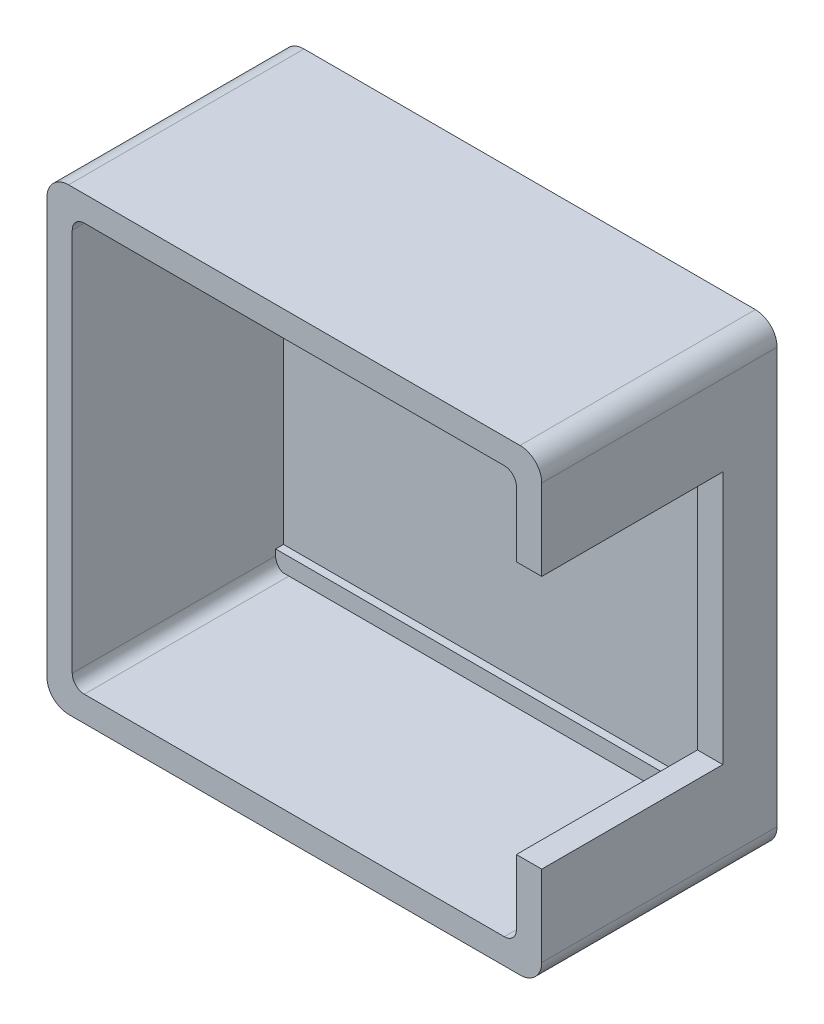
from build123d import *

# Parameters (mm, degrees)
FACTORY_ABS_FLOOR_41X38_DEPTH       = 2
FACTORY_ABS_SIDEWALLS_START         = 2
FACTORY_ABS_SIDEWALLS_DEPTH         = 17.5
FACTORY_TERMINAL_OPENING_START      = 4.5
FACTORY_TERMINAL_OPENING_SKETCH_W   = 3.2
FACTORY_TERMINAL_OPENING_SKETCH_H   = 21
FACTORY_TERMINAL_OPENING_DEPTH      = 15
FACTORY_MOUNTING_EAR_DEPTH          = 2
FACTORY_EAR_REFERENCE_HOLE_SKETCH_R = 1.5
FACTORY_EAR_REFERENCE_HOLE_DEPTH    = 2
PCB_SUPPORT_LEDGES_START            = 2
PCB_SUPPORT_LEDGES_SKETCH_W         = 36.9
PCB_SUPPORT_LEDGES_SKETCH_H         = 1.4
PCB_SUPPORT_LEDGES_DEPTH            = 0.65


with BuildPart() as part:
    # Factory_ABS_floor_41x38_Sketch → Factory_ABS_floor_41x38 (new body)
    with BuildSketch(Plane.XY):
        with BuildLine():
            Line((-18.7, -19), (18.7, -19))
            ThreePointArc((18.7, -19), (19.972792206, -18.472792206), (20.5, -17.2))
            Line((20.5, -17.2), (20.5, 17.2))
            ThreePointArc((20.5, 17.2), (19.972792206, 18.472792206), (18.7, 19))
            Line((18.7, 19), (-18.7, 19))
            ThreePointArc((-18.7, 19), (-19.972792206, 18.472792206), (-20.5, 17.2))
            Line((-20.5, 17.2), (-20.5, -17.2))
            ThreePointArc((-20.5, -17.2), (-19.972792206, -18.472792206), (-18.7, -19))
        make_face()
    extrude(amount=FACTORY_ABS_FLOOR_41X38_DEPTH)

    # Factory_ABS_sidewalls_Sketch → Factory_ABS_sidewalls (add)
    with BuildSketch(Plane.XY.offset(FACTORY_ABS_SIDEWALLS_START)):
        with BuildLine():
            Line((-18.7, -19), (18.7, -19))
            ThreePointArc((18.7, -19), (19.972792206, -18.472792206), (20.5, -17.2))
            Line((20.5, -17.2), (20.5, 17.2))
            ThreePointArc((20.5, 17.2), (19.972792206, 18.472792206), (18.7, 19))
            Line((18.7, 19), (-18.7, 19))
            ThreePointArc((-18.7, 19), (-19.972792206, 18.472792206), (-20.5, 17.2))
            Line((-20.5, 17.2), (-20.5, -17.2))
            ThreePointArc((-20.5, -17.2), (-19.972792206, -18.472792206), (-18.7, -19))
        make_face()
        with BuildLine():
            Line((-17.4, -16.9), (17.4, -16.9))
            ThreePointArc((17.4, -16.9), (18.107106781, -16.607106781), (18.4, -15.9))
            Line((18.4, -15.9), (18.4, 15.9))
            ThreePointArc((18.4, 15.9), (18.107106781, 16.607106781), (17.4, 16.9))
            Line((17.4, 16.9), (-17.4, 16.9))
            ThreePointArc((-17.4, 16.9), (-18.107106781, 16.607106781), (-18.4, 15.9))
            Line((-18.4, 15.9), (-18.4, -15.9))
            ThreePointArc((-18.4, -15.9), (-18.107106781, -16.607106781), (-17.4, -16.9))
        make_face(mode=Mode.SUBTRACT)
    extrude(amount=FACTORY_ABS_SIDEWALLS_DEPTH)

    # Factory_terminal_opening_Sketch → Factory_terminal_opening (cut)
    with BuildSketch(Plane.XY.offset(FACTORY_TERMINAL_OPENING_START)):
        with Locations((19.8, 0)):
            Rectangle(FACTORY_TERMINAL_OPENING_SKETCH_W, FACTORY_TERMINAL_OPENING_SKETCH_H)
    extrude(amount=FACTORY_TERMINAL_OPENING_DEPTH, mode=Mode.SUBTRACT)

    # Factory_mounting_ear_Sketch → Factory_mounting_ear (add)
    with BuildSketch(Plane.XY):
        with BuildLine():
            Line((-23, -5), (-21.7, -5))
            ThreePointArc((-21.7, -5), (-20.073654403, -4.326345597), (-19.4, -2.7))
            Line((-19.4, -2.7), (-19.4, 2.7))
            ThreePointArc((-19.4, 2.7), (-20.073654403, 4.326345597), (-21.7, 5))
            Line((-21.7, 5), (-23, 5))
            ThreePointArc((-23, 5), (-24.626345597, 4.326345597), (-25.3, 2.7))
            Line((-25.3, 2.7), (-25.3, -2.7))
            ThreePointArc((-25.3, -2.7), (-24.626345597, -4.326345597), (-23, -5))
        make_face()
    extrude(amount=FACTORY_MOUNTING_EAR_DEPTH)

    # Factory_ear_reference_hole_Sketch → Factory_ear_reference_hole (cut)
    with BuildSketch(Plane.XY):
        with Locations((-22.5, 0)):
            Circle(FACTORY_EAR_REFERENCE_HOLE_SKETCH_R)
    extrude(amount=FACTORY_EAR_REFERENCE_HOLE_DEPTH, mode=Mode.SUBTRACT)

    # PCB_support_ledges_Sketch → PCB_support_ledges (add)
    with BuildSketch(Plane.XY.offset(PCB_SUPPORT_LEDGES_START)):
        with Locations((0, -16.1)):
            Rectangle(PCB_SUPPORT_LEDGES_SKETCH_W, PCB_SUPPORT_LEDGES_SKETCH_H)
        with Locations((0, 16.1)):
            Rectangle(PCB_SUPPORT_LEDGES_SKETCH_W, PCB_SUPPORT_LEDGES_SKETCH_H)
    extrude(amount=PCB_SUPPORT_LEDGES_DEPTH)


solid = part.part
